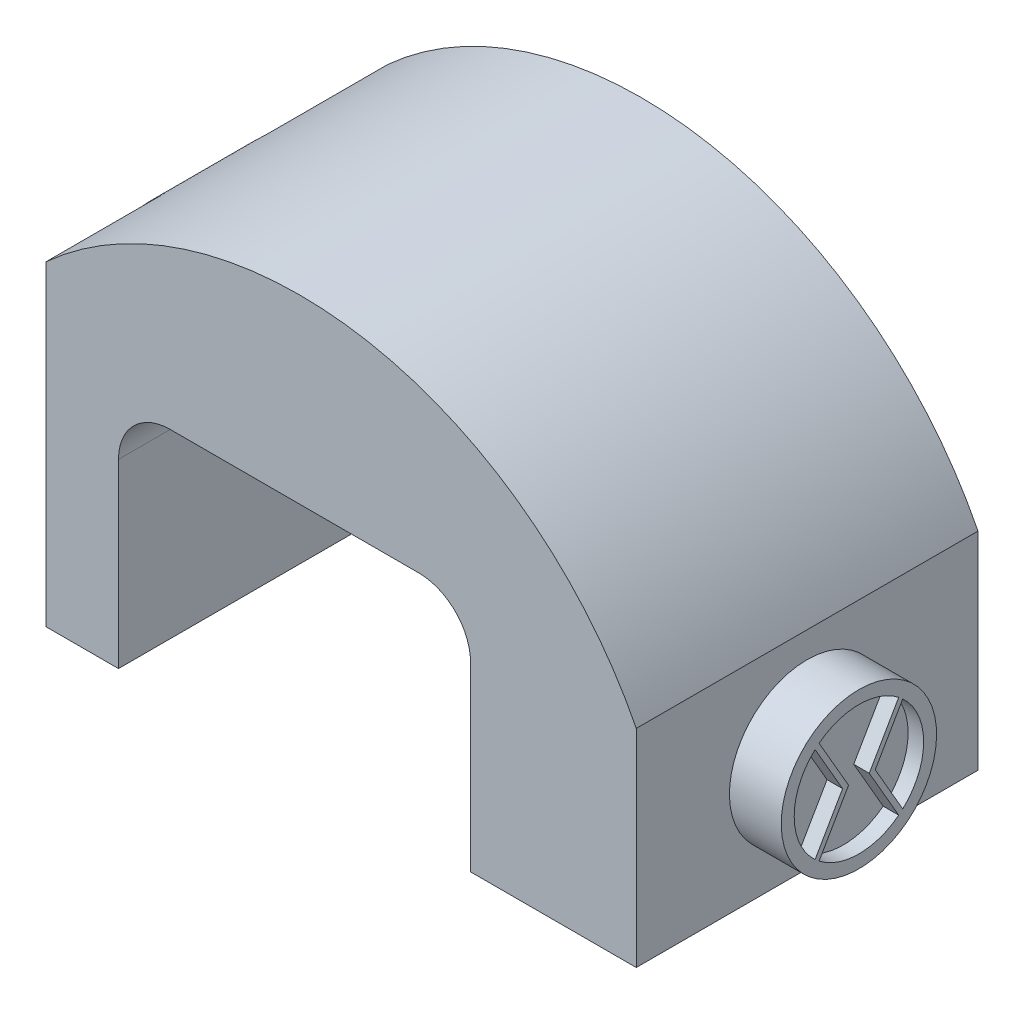
from build123d import *

# Parameters (mm, degrees)
BOSS_EXTRUDE1_DEPTH = 66
SKETCH4_R           = 15
BOSS_EXTRUDE2_DEPTH = 10
CUT_EXTRUDE2_DEPTH  = 108.615054709
SKETCH5_W           = 16
SKETCH5_H           = 23
CUT_EXTRUDE3_DEPTH  = 128.988280714
SKETCH6_W           = 10
SKETCH6_H           = 10
BOSS_EXTRUDE3_DEPTH = 5
SKETCH7_W           = 12
SKETCH7_H           = 12
BOSS_EXTRUDE4_DEPTH = 5
CUT_EXTRUDE4_DEPTH  = 3


with BuildPart() as part:
    # Sketch2 → Boss-Extrude1 (new body)
    with BuildSketch(Plane.XY):
        with BuildLine():
            ThreePointArc((65, 0), (38.160843726, 29.198871234), (-1.89e-07, 40))
            ThreePointArc((-1.89e-07, 40), (-38.160843886, 29.198871136), (-65, 0))
            Line((-65, 0), (-65, -40))
            Line((-65, -40), (65, -40))
            Line((65, -40), (65, 0))
        make_face()
    extrude(amount=BOSS_EXTRUDE1_DEPTH)

    # Sketch4 → Boss-Extrude2 (add)
    with BuildSketch(Plane(origin=(65, 0, 0), x_dir=(0, 0, -1), z_dir=(1, 0, 0))):
        with Locations(Location((-33, -20, 0), (0, 0, 90))):
            Circle(SKETCH4_R)
    extrude(amount=BOSS_EXTRUDE2_DEPTH)

    # Sketch3 → Cut-Extrude2 (cut, through all)
    with BuildSketch(Plane.XY.offset(66)):
        with BuildLine():
            Line((-25, 5), (23, 5))
            ThreePointArc((23, 5), (30.071067812, 2.071067812), (33, -5))
            Line((33, -5), (33, -40))
            Line((33, -40), (-35, -40))
            Line((-35, -40), (-35, -5))
            ThreePointArc((-35, -5), (-32.071067812, 2.071067812), (-25, 5))
        make_face()
    extrude(amount=-CUT_EXTRUDE2_DEPTH, mode=Mode.SUBTRACT)

    # Sketch5 → Cut-Extrude3 (cut, through all)
    with BuildSketch(Plane.XZ.offset(40)):
        with Locations((-57, 54.5)):
            Rectangle(SKETCH5_W, SKETCH5_H)
        with Locations((-57, 11.5)):
            Rectangle(SKETCH5_W, SKETCH5_H)
    extrude(amount=-CUT_EXTRUDE3_DEPTH, mode=Mode.SUBTRACT)

    # Sketch6 → Boss-Extrude3 (add)
    with BuildSketch(Plane.XZ.offset(40)):
        with Locations((-48.5, 33)):
            Rectangle(SKETCH6_W, SKETCH6_H)
    extrude(amount=BOSS_EXTRUDE3_DEPTH)

    # Sketch7 → Boss-Extrude4 (add)
    with BuildSketch(Plane.XZ.offset(40)):
        with Locations((41.5, 13.9)):
            Rectangle(SKETCH7_W, SKETCH7_H)
        with Locations((41.5, 52.1)):
            Rectangle(SKETCH7_W, SKETCH7_H)
    extrude(amount=BOSS_EXTRUDE4_DEPTH)

    # Sketch8 → Cut-Extrude4 (cut)
    with BuildSketch(Plane(origin=(75, 0, 0), x_dir=(0, 0, -1), z_dir=(1, 0, 0))):
        with BuildLine():
            Line((-40.689709202, -10.145134583), (-35, -20))
            Line((-35, -20), (-40.689709202, -29.854865417))
            ThreePointArc((-40.689709202, -29.854865417), (-33, -32.5), (-25.310290798, -29.854865417))
            Line((-25.310290798, -29.854865417), (-31, -20))
            Line((-31, -20), (-25.310290798, -10.145134583))
            ThreePointArc((-25.310290798, -10.145134583), (-33, -7.5), (-40.689709202, -10.145134583))
        make_face()
        with BuildLine():
            Line((-36.154700538, -20), (-41.464916663, -10.802435872))
            ThreePointArc((-41.464916663, -10.802435872), (-45.5, -20), (-41.464916663, -29.197564128))
            Line((-41.464916663, -29.197564128), (-36.154700538, -20))
        make_face()
        with BuildLine():
            ThreePointArc((-24.535083337, -29.197564128), (-20.5, -20), (-24.535083337, -10.802435872))
            Line((-24.535083337, -10.802435872), (-29.845299462, -20))
            Line((-29.845299462, -20), (-24.535083337, -29.197564128))
        make_face()
    extrude(amount=-CUT_EXTRUDE4_DEPTH, mode=Mode.SUBTRACT)


solid = part.part
